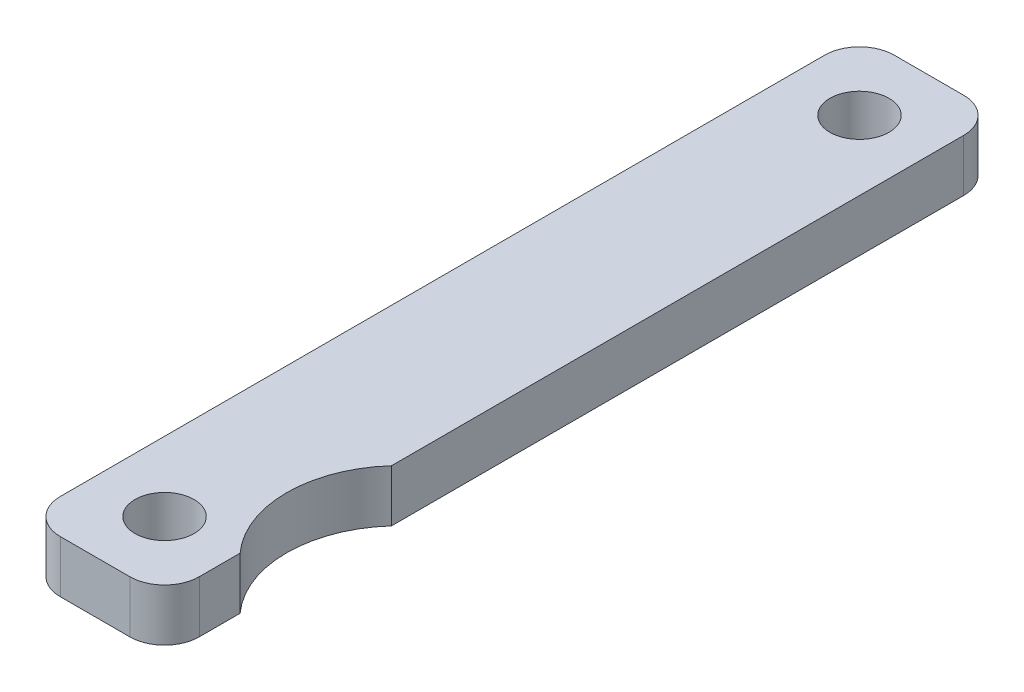
from build123d import *

# Parameters (mm, degrees)
SKETCH_1_R          = 1.7
EXTRUDE_1_DEPTH     = 3
CUT_EXTRUDE_1_DEPTH = 3


with BuildPart() as part:
    # 草圖1 → 填料-伸長1 (new body)
    with BuildSketch(Plane(origin=(0, 0, 0), x_dir=(1, 0, 0), z_dir=(0, 1, 0))):
        with BuildLine():
            Line((-2, 24), (2, 24))
            ThreePointArc((2, 24), (3.414213562, 23.414213562), (4, 22))
            Line((4, 22), (4, -22))
            ThreePointArc((4, -22), (3.414213562, -23.414213562), (2, -24))
            Line((2, -24), (-2, -24))
            ThreePointArc((-2, -24), (-3.414213562, -23.414213562), (-4, -22))
            Line((-4, -22), (-4, 22))
            ThreePointArc((-4, 22), (-3.414213562, 23.414213562), (-2, 24))
        make_face()
        with Locations(Location((0, 20, 0), (0, 0, 270))):
            Circle(SKETCH_1_R, mode=Mode.SUBTRACT)
        with Locations(Location((0, -20, 0), (0, 0, 90))):
            Circle(SKETCH_1_R, mode=Mode.SUBTRACT)
    extrude(amount=EXTRUDE_1_DEPTH)

    # 草圖2 → 除料-伸長1 (cut)
    with BuildSketch(Plane(origin=(0, 3, 0), x_dir=(1, 0, 0), z_dir=(0, 1, 0))):
        with BuildLine():
            Line((4, -10.936925409), (8.605915435, -21.790363308))
            ThreePointArc((8.605915435, -21.790363308), (2.8399706, -17.8332456), (4, -10.936925409))
        make_face()
    extrude(amount=-CUT_EXTRUDE_1_DEPTH, mode=Mode.SUBTRACT)


solid = part.part
